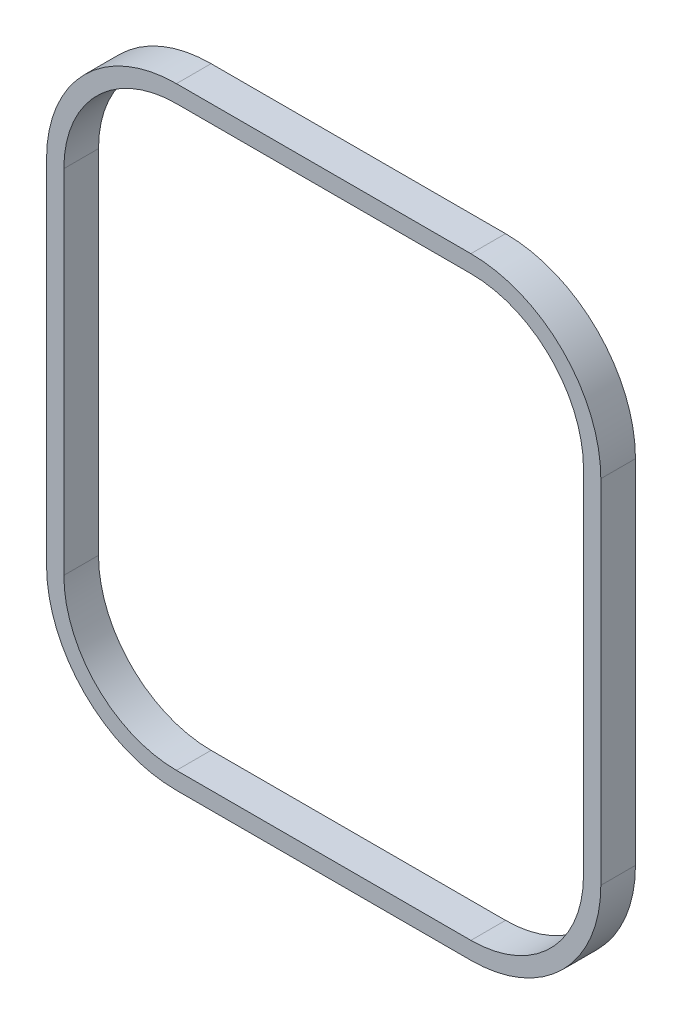
from build123d import *

# Parameters (mm, degrees)
EXTRUDE_1_DEPTH = 12


with BuildPart() as part:
    # Эскиз1 → Вытянуть-Тонкостенный1 (new body)
    with BuildSketch(Plane.XY):
        with BuildLine():
            Line((-51, 106), (51, 106))
            ThreePointArc((51, 106), (82.819805153, 92.819805153), (96, 61))
            Line((96, 61), (96, -61))
            ThreePointArc((96, -61), (82.819805153, -92.819805153), (51, -106))
            Line((51, -106), (-51, -106))
            ThreePointArc((-51, -106), (-82.819805153, -92.819805153), (-96, -61))
            Line((-96, -61), (-96, 61))
            ThreePointArc((-96, 61), (-82.819805153, 92.819805153), (-51, 106))
        make_face()
        with BuildLine():
            Line((-51, 100), (51, 100))
            ThreePointArc((51, 100), (78.577164466, 88.577164466), (90, 61))
            Line((90, 61), (90, -61))
            ThreePointArc((90, -61), (78.577164466, -88.577164466), (51, -100))
            Line((51, -100), (-51, -100))
            ThreePointArc((-51, -100), (-78.577164466, -88.577164466), (-90, -61))
            Line((-90, -61), (-90, 61))
            ThreePointArc((-90, 61), (-78.577164466, 88.577164466), (-51, 100))
        make_face(mode=Mode.SUBTRACT)
    extrude(amount=EXTRUDE_1_DEPTH)


solid = part.part
